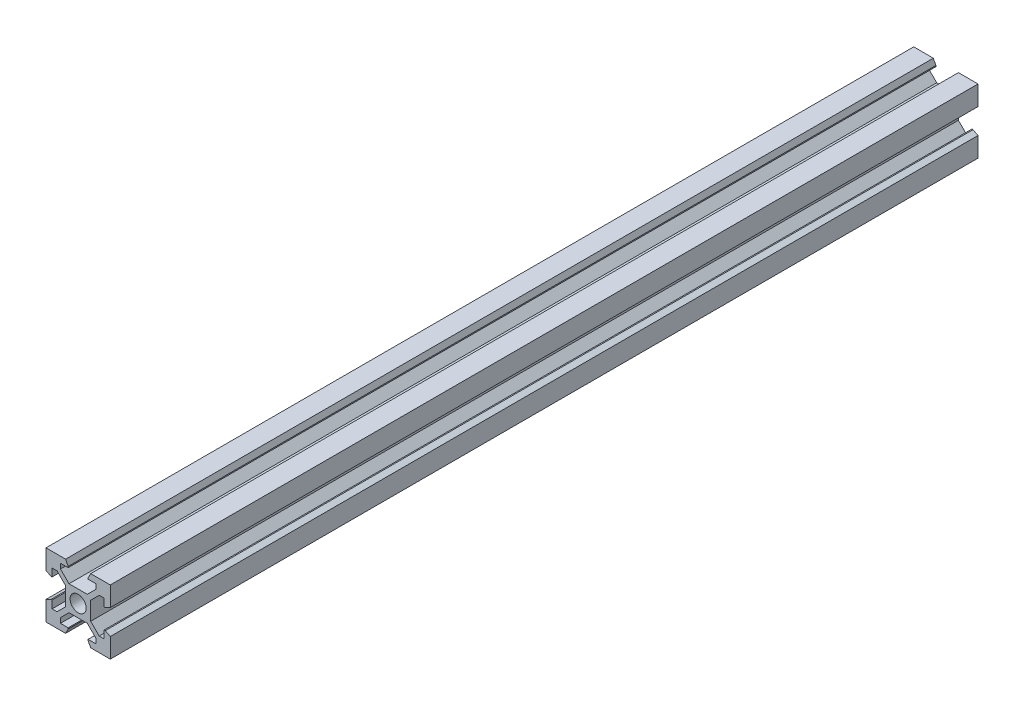
from build123d import *

# Parameters (mm, degrees)
SKETCH1_R           = 2.5
BOSS_EXTRUDE1_DEPTH = 270


with BuildPart() as part:
    # Sketch1 → Boss-Extrude1 (new body)
    with BuildSketch(Plane.XY):
        Polygon((6.1, 20), (0, 20), (0, 13.895792909), (1.56, 13.1), (1.9, 13.1), (1.9, 15.5), (3.439339828, 15.5), (6.1, 12.839339828), (6.1, 7.160660172), (3.439339828, 4.5), (1.9, 4.5), (1.9, 6.9), (1.56, 6.9), (0, 6.104207091), (0, 0), (6.1, 0), (6.9, 1.56), (6.9, 1.9), (4.5, 1.9), (4.5, 3.439339828), (7.160660172, 6.1), (12.839339828, 6.1), (15.5, 3.439339828), (15.5, 1.9), (13.1, 1.9), (13.1, 1.56), (13.9, 0), (20, 0), (20, 6.104207091), (18.44, 6.9), (18.1, 6.9), (18.1, 4.5), (16.560660172, 4.5), (13.9, 7.160660172), (13.9, 12.839339828), (16.560660172, 15.5), (18.1, 15.5), (18.1, 13.1), (18.44, 13.1), (20, 13.895792909), (20, 20), (13.9, 20), (13.1, 18.44), (13.1, 18.1), (15.5, 18.1), (15.5, 16.560660172), (12.839339828, 13.9), (7.160660172, 13.9), (4.5, 16.560660172), (4.5, 18.1), (6.9, 18.1), (6.9, 18.44), align=None)
        with Locations((10, 10)):
            Circle(SKETCH1_R, mode=Mode.SUBTRACT)
    extrude(amount=BOSS_EXTRUDE1_DEPTH)


solid = part.part
